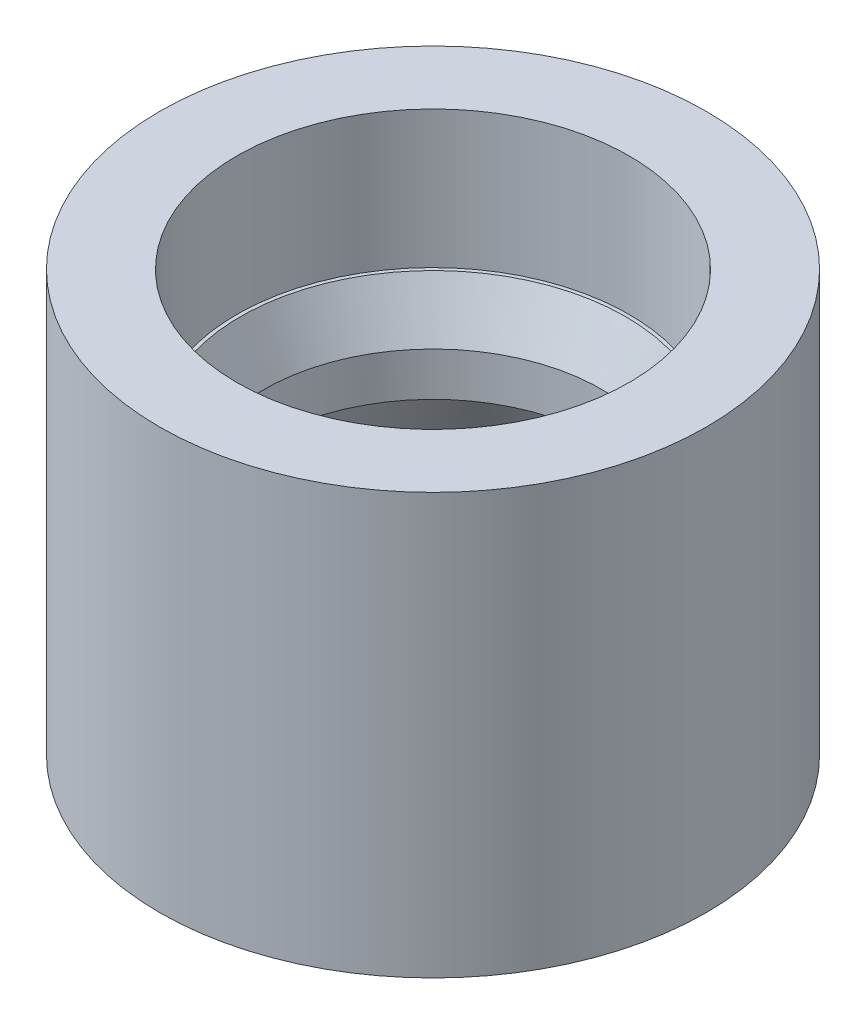
from build123d import *
from OCP.BRepFilletAPI import BRepFilletAPI_MakeChamfer

# Parameters (mm, degrees)
SKETCH1_R           = 12
SKETCH1_R_2         = 5
BOSS_EXTRUDE1_DEPTH = 15
SKETCH2_R           = 7
CUT_EXTRUDE1_DEPTH  = 5.1
CUT_EXTRUDE2_START  = -5.1
SKETCH3_R           = 7
CUT_EXTRUDE2_DEPTH  = 5.1
BOSS_EXTRUDE2_START = -4.8
SKETCH4_R           = 5
SKETCH4_R_2         = 3
BOSS_EXTRUDE2_DEPTH = 4.8
SKETCH5_R           = 17.644165846
SKETCH5_R_2         = 10
CUT_EXTRUDE3_DEPTH  = 17.1
SKETCH6_R           = 7.1
CUT_EXTRUDE4_DEPTH  = 5.1
CUT_EXTRUDE5_START  = -5.1
SKETCH7_R           = 7.1
CUT_EXTRUDE5_DEPTH  = 5.1
SKETCH8_R           = 14.835126002
SKETCH8_R_2         = 9.75
CUT_EXTRUDE7_DEPTH  = 26
SKETCH9_R           = 6.0214871
CUT_EXTRUDE8_DEPTH  = 10
BOSS_EXTRUDE3_START = 0.2
SKETCH10_R          = 7.1
SKETCH10_R_2        = 6.0214871
BOSS_EXTRUDE3_DEPTH = 0.2
SKETCH11_R          = 7.1
SKETCH11_R_2        = 6.0214871
BOSS_EXTRUDE4_DEPTH = 0.2
CHAMFER2_SIZE       = 0.85
CHAMFER2_SIZE2      = 1.822830882
BOSS_EXTRUDE5_REACH = 22.375
SKETCH12_R          = 9.75
SKETCH12_R_2        = 7


with BuildPart() as part:
    # Sketch1 → Boss-Extrude1 (new body)
    with BuildSketch(Plane(origin=(0, 0, 0), x_dir=(1, 0, 0), z_dir=(0, 1, 0))):
        with Locations(Location((0, 0, 0), (0, 0, 270))):
            Circle(SKETCH1_R)
        with Locations(Location((0, 0, 0), (0, 0, 270))):
            Circle(SKETCH1_R_2, mode=Mode.SUBTRACT)
    extrude(amount=BOSS_EXTRUDE1_DEPTH)

    # Sketch2 → Cut-Extrude1 (cut)
    with BuildSketch(Plane.XZ):
        with Locations(Location((0, 0, 0), (0, 0, 270))):
            Circle(SKETCH2_R)
    extrude(amount=-CUT_EXTRUDE1_DEPTH, mode=Mode.SUBTRACT)

    # Sketch3 → Cut-Extrude2 (cut)
    with BuildSketch(Plane(origin=(0, 15, 0), x_dir=(1, 0, 0), z_dir=(0, 1, 0)).offset(CUT_EXTRUDE2_START)):
        with Locations(Location((0, 0, 0), (0, 0, 90))):
            Circle(SKETCH3_R)
    extrude(amount=CUT_EXTRUDE2_DEPTH, mode=Mode.SUBTRACT)

    # Sketch4 → Boss-Extrude2 (add)
    with BuildSketch(Plane(origin=(0, 9.9, 0), x_dir=(1, 0, 0), z_dir=(0, 1, 0)).offset(BOSS_EXTRUDE2_START)):
        Circle(SKETCH4_R)
        with Locations(Location((0, 0, 0), (0, 0, 270))):
            Circle(SKETCH4_R_2, mode=Mode.SUBTRACT)
    extrude(amount=BOSS_EXTRUDE2_DEPTH)

    # Sketch5 → Cut-Extrude3 (cut)
    with BuildSketch(Plane.XZ):
        Circle(SKETCH5_R)
        with Locations(Location((0, 0, 0), (0, 0, 270))):
            Circle(SKETCH5_R_2, mode=Mode.SUBTRACT)
    extrude(amount=-CUT_EXTRUDE3_DEPTH, mode=Mode.SUBTRACT)

    # Sketch6 → Cut-Extrude4 (cut)
    with BuildSketch(Plane.XZ):
        with Locations(Location((0, 0, 0), (0, 0, 270))):
            Circle(SKETCH6_R)
    extrude(amount=-CUT_EXTRUDE4_DEPTH, mode=Mode.SUBTRACT)

    # Sketch7 → Cut-Extrude5 (cut)
    with BuildSketch(Plane(origin=(0, 15, 0), x_dir=(1, 0, 0), z_dir=(0, 1, 0)).offset(CUT_EXTRUDE5_START)):
        with Locations(Location((0, 0, 0), (0, 0, 90))):
            Circle(SKETCH7_R)
    extrude(amount=CUT_EXTRUDE5_DEPTH, mode=Mode.SUBTRACT)

    # Sketch8 → Cut-Extrude7 (cut)
    with BuildSketch(Plane.XZ):
        Circle(SKETCH8_R)
        with Locations(Location((0, 0, 0), (0, 0, 270))):
            Circle(SKETCH8_R_2, mode=Mode.SUBTRACT)
    extrude(amount=-CUT_EXTRUDE7_DEPTH, mode=Mode.SUBTRACT)

    # Sketch9 → Cut-Extrude8 (cut)
    with BuildSketch(Plane(origin=(0, 9.9, 0), x_dir=(1, 0, 0), z_dir=(0, 1, 0))):
        with Locations(Location((0, 0, 0), (0, 0, 270))):
            Circle(SKETCH9_R)
    extrude(amount=-CUT_EXTRUDE8_DEPTH, mode=Mode.SUBTRACT)

    # Sketch10 → Boss-Extrude3 (add)
    with BuildSketch(Plane.XZ.offset(-5.1).offset(BOSS_EXTRUDE3_START)):
        with Locations(Location((0, 0, 0), (0, 0, 270))):
            Circle(SKETCH10_R)
        with Locations(Location((0, 0, 0), (0, 0, 90))):
            Circle(SKETCH10_R_2, mode=Mode.SUBTRACT)
    extrude(amount=-BOSS_EXTRUDE3_DEPTH)

    # Sketch11 → Boss-Extrude4 (add)
    with BuildSketch(Plane(origin=(0, 9.9, 0), x_dir=(1, 0, 0), z_dir=(0, 1, 0))):
        with Locations(Location((0, 0, 0), (0, 0, 90))):
            Circle(SKETCH11_R)
        with Locations(Location((0, 0, 0), (0, 0, 270))):
            Circle(SKETCH11_R_2, mode=Mode.SUBTRACT)
    extrude(amount=BOSS_EXTRUDE4_DEPTH)

    # Chamfer2: one chamfer whose edges measure the first distance from different faces: ONE call of the kernel's chamfer builder (chamfer() names one face for all edges)
    chamfer2_edges_1 = [part.edges().sort_by_distance(p)[0] for p in [
        (0, 4.9, -6.0214871),
    ]]
    chamfer2_side_1 = [part.faces().sort_by_distance(p)[0] for p in [
        (0, 4.9, 6.899181674),
    ]]
    chamfer2_edges_2 = [part.edges().sort_by_distance(p)[0] for p in [
        (0, 10.1, -6.0214871),
    ]]
    chamfer2_side_2 = [part.faces().sort_by_distance(p)[0] for p in [
        (0, 10.1, 6.899181674),
    ]]
    chamfer2 = BRepFilletAPI_MakeChamfer(part.part.solid().wrapped)
    for e in chamfer2_edges_1:
        chamfer2.Add(CHAMFER2_SIZE, CHAMFER2_SIZE2, e.wrapped, chamfer2_side_1[0].wrapped)  # the first distance lies on this face
    for e in chamfer2_edges_2:
        chamfer2.Add(CHAMFER2_SIZE, CHAMFER2_SIZE2, e.wrapped, chamfer2_side_2[0].wrapped)  # the first distance lies on this face
    add(Compound.cast(chamfer2.Shape()), mode=Mode.REPLACE)

    # Boss-Extrude5: up to this face of the body (flat: up to its plane)
    boss_extrude5_end = Plane(part.part.faces().sort_by_distance((0, 0, 9.474228355))[0])
    # Sketch12 → Boss-Extrude5 (add, up to the picked face)
    with BuildSketch(Plane(origin=(0, 15, 0), x_dir=(1, 0, 0), z_dir=(0, 1, 0)), mode=Mode.PRIVATE) as boss_extrude5_sk1:
        with Locations(Location((0, 0, 0), (0, 0, 90))):
            Circle(SKETCH12_R)
        with Locations(Location((0, 0, 0), (0, 0, 270))):
            Circle(SKETCH12_R_2, mode=Mode.SUBTRACT)
    boss_extrude5_tool1 = split(extrude(boss_extrude5_sk1.sketch, amount=-BOSS_EXTRUDE5_REACH, mode=Mode.PRIVATE), bisect_by=boss_extrude5_end, keep=Keep.BOTH, mode=Mode.PRIVATE)
    add(boss_extrude5_tool1.solids().sort_by(Axis((0, 15, 9.474228), (0, -1, 0)))[0])


solid = part.part
